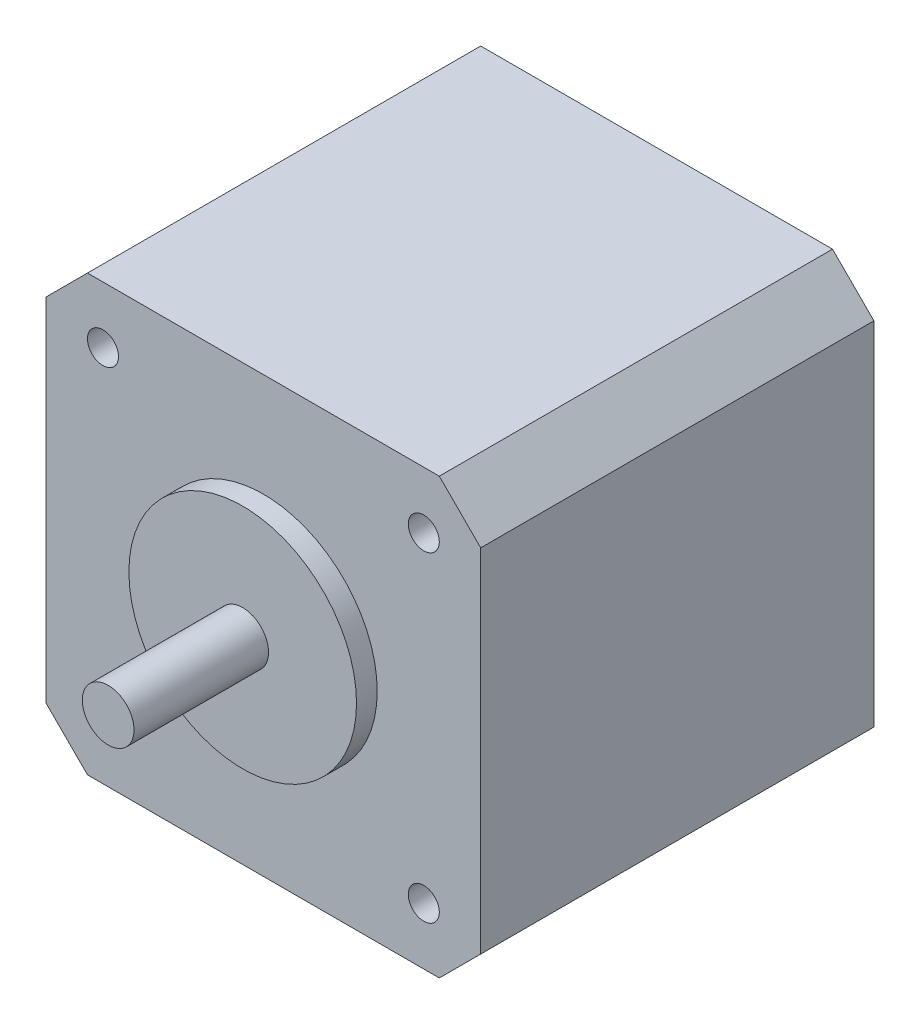
from build123d import *

# Parameters (mm, degrees)
CROQUIS1_W              = 42
CROQUIS1_H              = 42
SALIENTE_EXTRUIR1_DEPTH = 38
CROQUIS2_R              = 11
SALIENTE_EXTRUIR2_DEPTH = 2
CROQUIS3_R              = 2.5
SALIENTE_EXTRUIR3_DEPTH = 13
CHAFL_N1_SIZE           = 4
CROQUIS4_R              = 1.5
CORTAR_EXTRUIR1_DEPTH   = 49.228622207
SALIENTE_EXTRUIR4_DEPTH = 3


with BuildPart() as part:
    # Croquis1 → Saliente-Extruir1 (new body)
    with BuildSketch(Plane.XY):
        Rectangle(CROQUIS1_W, CROQUIS1_H)
    extrude(amount=SALIENTE_EXTRUIR1_DEPTH)

    # Croquis2 → Saliente-Extruir2 (add)
    with BuildSketch(Plane.XY.offset(38)):
        Circle(CROQUIS2_R)
    extrude(amount=SALIENTE_EXTRUIR2_DEPTH)

    # Croquis3 → Saliente-Extruir3 (add)
    with BuildSketch(Plane.XY.offset(40)):
        with Locations(Location((0, 0, 0), (0, 0, 180))):
            Circle(CROQUIS3_R)
    extrude(amount=SALIENTE_EXTRUIR3_DEPTH)

    # Chaflán1
    chafl_n1_edges = [part.edges().sort_by_distance(p)[0] for p in [
        (21, -21, 19),
        (-21, -21, 19),
        (-21, 21, 19),
        (21, 21, 19),
    ]]
    chamfer(chafl_n1_edges, length=CHAFL_N1_SIZE)

    # Croquis4 → Cortar-Extruir1 (cut, through all)
    with BuildSketch(Plane.XY.offset(38)):
        with Locations((15.5, 15.5)):
            Circle(CROQUIS4_R)
        with Locations((-15.5, 15.5)):
            Circle(CROQUIS4_R)
        with Locations((-15.5, -15.5)):
            Circle(CROQUIS4_R)
        with Locations((15.5, -15.5)):
            Circle(CROQUIS4_R)
    extrude(amount=-CORTAR_EXTRUIR1_DEPTH, mode=Mode.SUBTRACT)

    # Croquis6 → Saliente-Extruir4 (add)
    with BuildSketch(Plane.XZ.offset(21)):
        with BuildLine():
            Line((1.353116467, 3.113624341), (-1.353116467, 3.113624341))
            ThreePointArc((-1.353116467, 3.113624341), (-2.014015037, 3.77452291), (-1.353116467, 4.43542148))
            Line((-1.353116467, 4.43542148), (1.353116467, 4.43542148))
            ThreePointArc((1.353116467, 4.43542148), (2.014015037, 3.77452291), (1.353116467, 3.113624341))
        make_face()
    extrude(amount=SALIENTE_EXTRUIR4_DEPTH)


solid = part.part
